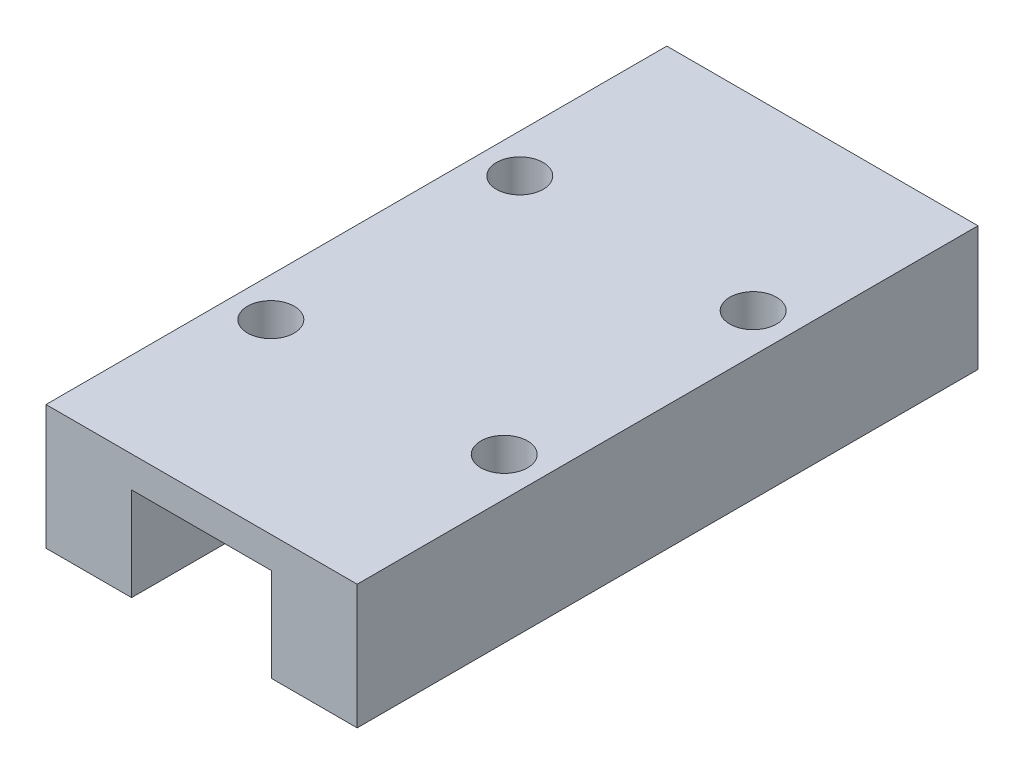
from build123d import *

# Parameters (mm, degrees)
SKETCH_1_W          = 20
SKETCH_1_H          = 39.9
SKETCH_1_R          = 1.5
EXTRUDE_1_DEPTH     = 8
SKETCH_2_W          = 9
SKETCH_2_H          = 6
CUT_EXTRUDE_1_DEPTH = 60


with BuildPart() as part:
    # 草图1 → 凸台-拉伸1 (new body)
    with BuildSketch(Plane(origin=(0, 0, 0), x_dir=(1, 0, 0), z_dir=(0, 1, 0))):
        Rectangle(SKETCH_1_W, SKETCH_1_H)
        with Locations(Location((-7.5, 8, 0), (0, 0, 270))):
            Circle(SKETCH_1_R, mode=Mode.SUBTRACT)
        with Locations(Location((-7.5, -8, 0), (0, 0, 90))):
            Circle(SKETCH_1_R, mode=Mode.SUBTRACT)
        with Locations(Location((7.5, -8, 0), (0, 0, 270))):
            Circle(SKETCH_1_R, mode=Mode.SUBTRACT)
        with Locations(Location((7.5, 8, 0), (0, 0, 90))):
            Circle(SKETCH_1_R, mode=Mode.SUBTRACT)
    extrude(amount=EXTRUDE_1_DEPTH)

    # 草图2 → 切除-拉伸1 (cut)
    with BuildSketch(Plane.XY.offset(19.95)):
        with Locations((0, 3)):
            Rectangle(SKETCH_2_W, SKETCH_2_H)
    extrude(amount=-CUT_EXTRUDE_1_DEPTH, mode=Mode.SUBTRACT)


solid = part.part
